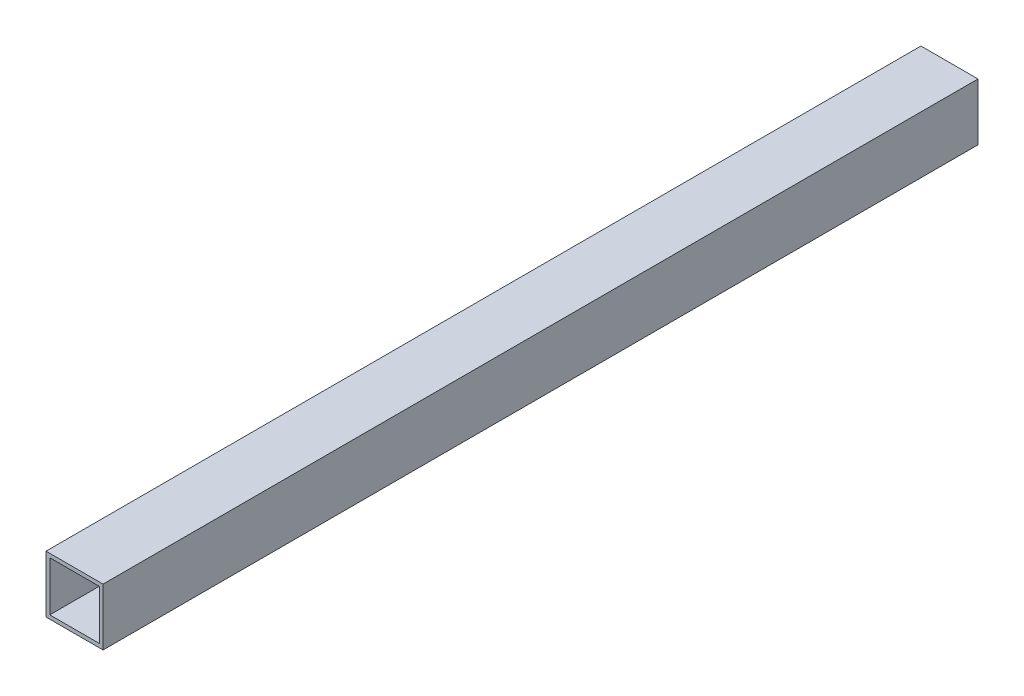
from build123d import *

# Parameters (mm, degrees)
CROQUIS1_W            = 30
CROQUIS1_H            = 30
CROQUIS1_W_2          = 26
CROQUIS1_H_2          = 26
EXTRUIR_L_MINA1_DEPTH = 460


with BuildPart() as part:
    # Croquis1 → Extruir-Lámina1 (new body)
    with BuildSketch(Plane.XY):
        Rectangle(CROQUIS1_W, CROQUIS1_H)
        Rectangle(CROQUIS1_W_2, CROQUIS1_H_2, mode=Mode.SUBTRACT)
    extrude(amount=EXTRUIR_L_MINA1_DEPTH)


solid = part.part
